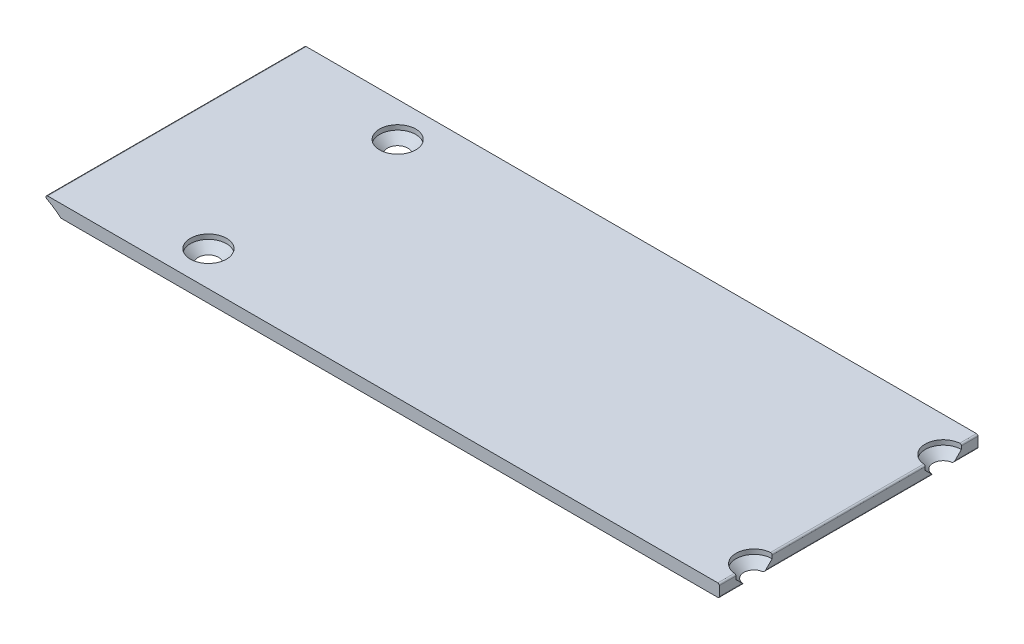
from build123d import *

# Parameters (mm, degrees)
AUFSATZ_LINEAR_START                        = -8.5
AUFSATZ_LINEAR_AUSTRAGEN1_DEPTH             = 41
VERRUNDUNG1_R                               = 0.5
FORMSENKUNG_F_R_M5_SENKSCHRAUBE_MIT_2_COUNT = 2
FORMSENKUNG_F_R_M5_SENKSCHRAUBE_MIT_2_PITCH = 173


with BuildPart() as part:
    # Skizze2 → Aufsatz-Linear austragen1 (new body)
    with BuildSketch(Plane.XY.offset(AUFSATZ_LINEAR_START)):
        with BuildLine():
            Line((9.797958971, 23), (225, 23))
            Line((225, 23), (225, 19))
            Line((225, 19), (17.007351352, 19))
            Line((17.007351352, 19), (16.248076809, 19))
            ThreePointArc((16.248076809, 19), (13.175697134, 21.246199779), (9.797958971, 23))
        make_face()
    extrude(amount=-AUFSATZ_LINEAR_AUSTRAGEN1_DEPTH)

    # Verrundung1
    verrundung1_edges = [part.edges().sort_by_distance(p)[0] for p in [
        (16.248076809, 19, -29),
        (9.797958971, 23, -29),
        (225, 23, -29),
        (225, 19, -29),
    ]]
    fillet(verrundung1_edges, radius=VERRUNDUNG1_R)

    # Skizze6 → Formsenkung für M5 Senkschraube mit Innensechskant1 (revolve, cut)
    with BuildSketch(Plane(origin=(225, 23, -19.5), x_dir=(0, 0, 1), z_dir=(1, 0, 0))):
        Polygon((0, 0), (0, 5.652366702), (2.75, 4), (2.75, 4.485), (5.735, 1.5), (5.735, 0), align=None)
    formsenkung_f_r_m5_senkschraube_mit_inne = revolve(axis=Axis((225, 29.35, -19.5), (0, -1, 0)), mode=Mode.SUBTRACT)

    # Formsenkung f_r M5 Senkschraube mit  2: Formsenkung für M5 Senkschraube mit Innensechskant1 ×2
    with Locations(*[(-i * FORMSENKUNG_F_R_M5_SENKSCHRAUBE_MIT_2_PITCH, 0, 0) for i in range(1, FORMSENKUNG_F_R_M5_SENKSCHRAUBE_MIT_2_COUNT)]):
        add(formsenkung_f_r_m5_senkschraube_mit_inne, mode=Mode.SUBTRACT)

    # Spiegeln2: part across plane


with BuildPart() as part_1:
    add(part.part)
    add(part.part.mirror(Plane.XY.offset(-49.5)))


solid = part_1.part
